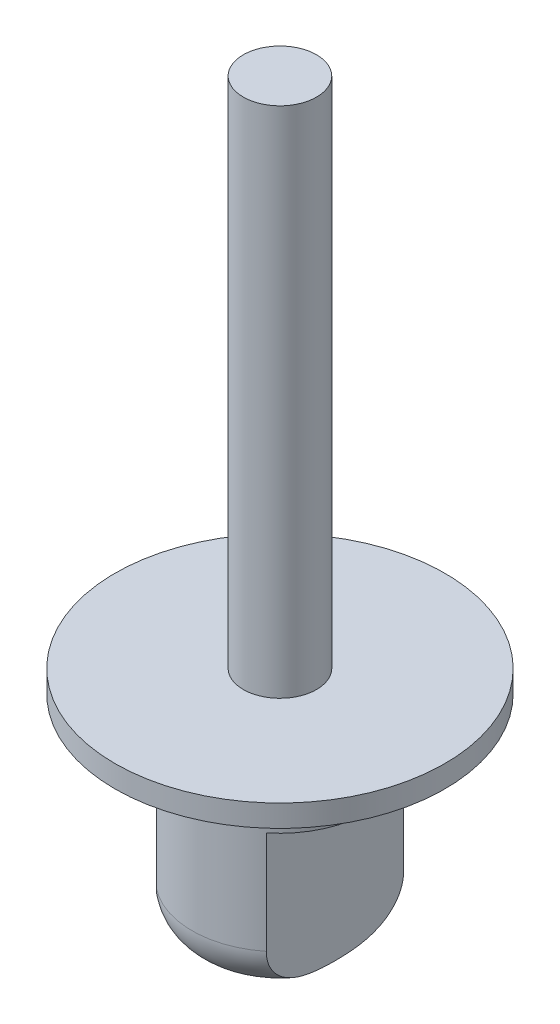
from build123d import *

# Parameters (mm, degrees)
SKETCH1_R               = 22.5
BOSS_EXTRUDE1_DEPTH     = 3
SKETCH2_R               = 5
BOSS_EXTRUDE2_DEPTH     = 70
SKETCH3_R               = 12
BOSS_EXTRUDE3_DEPTH     = 28
FILLET1_R               = 6
CUT_EXTRUDE1_DEPTH      = 80.633535649
CUT_EXTRUDE1_DEPTH_BACK = 80.633535649
SKETCH4_W               = 19.57
SKETCH4_H               = 20


with BuildPart() as part:
    # Sketch1 → Boss-Extrude1 (new body)
    with BuildSketch(Plane(origin=(0, 0, 0), x_dir=(1, 0, 0), z_dir=(0, 1, 0))):
        with Locations(Location((0, 0, 0), (0, 0, 270))):
            Circle(SKETCH1_R)
    extrude(amount=BOSS_EXTRUDE1_DEPTH)

    # Sketch2 → Boss-Extrude2 (add)
    with BuildSketch(Plane(origin=(0, 3, 0), x_dir=(1, 0, 0), z_dir=(0, 1, 0))):
        with Locations(Location((0, 0, 0), (0, 0, 270))):
            Circle(SKETCH2_R)
    extrude(amount=BOSS_EXTRUDE2_DEPTH)

    # Sketch3 → Boss-Extrude3 (add)
    with BuildSketch(Plane.XZ):
        with Locations(Location((0, 0, 0), (0, 0, 270))):
            Circle(SKETCH3_R)
    extrude(amount=BOSS_EXTRUDE3_DEPTH)

    # Fillet1
    fillet1_edges = [part.edges().sort_by_distance(p)[0] for p in [
        (0, -28, 12),
    ]]
    fillet(fillet1_edges, radius=FILLET1_R)

    # Sketch4 → Cut-Extrude1 (cut, two sides: drawn at the far end of the back side and taken through both)
    with BuildSketch(Plane.XY.offset(-CUT_EXTRUDE1_DEPTH_BACK)):
        with Locations((17.285, -18)):
            Rectangle(SKETCH4_W, SKETCH4_H)
        with Locations((-17.285, -18)):
            Rectangle(SKETCH4_W, SKETCH4_H)
    extrude(amount=CUT_EXTRUDE1_DEPTH + CUT_EXTRUDE1_DEPTH_BACK, mode=Mode.SUBTRACT)


solid = part.part
